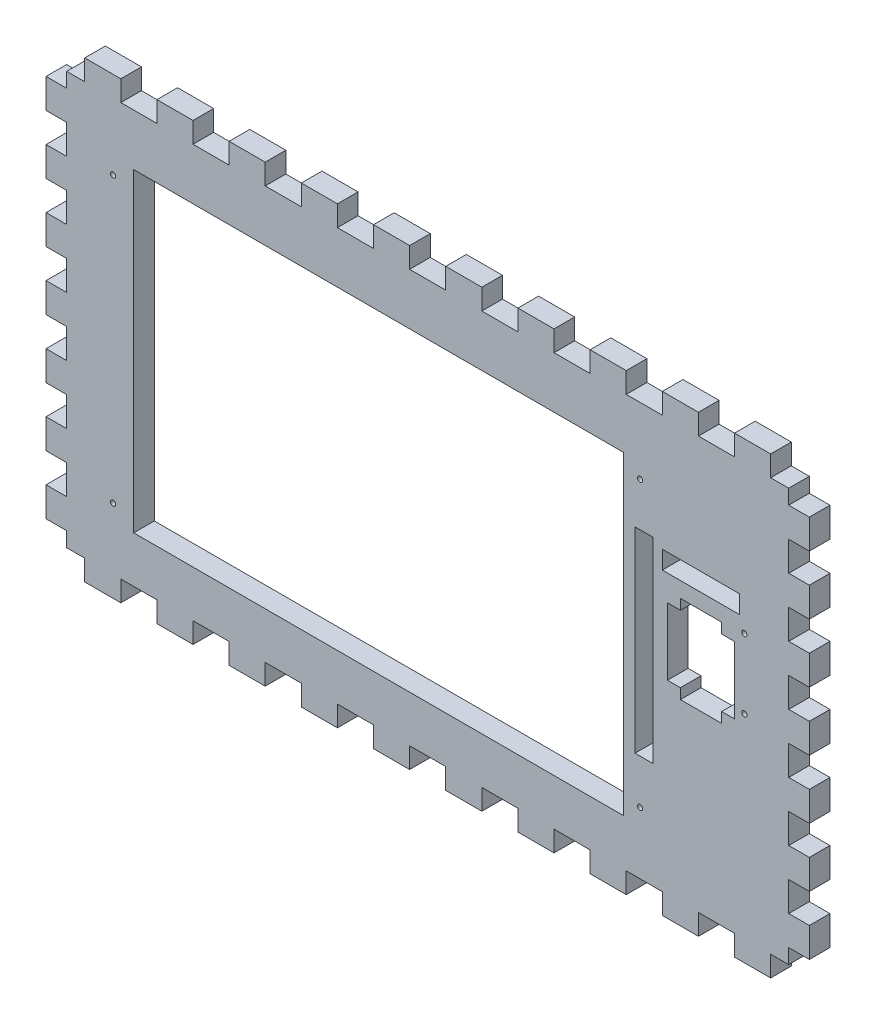
from build123d import *

# Parameters (mm, degrees)
SCHIZZO1_W                   = 140
SCHIZZO1_H                   = 80
SCHIZZO1_R                   = 0.5
SCHIZZO1_W_2                 = 95
SCHIZZO1_H_2                 = 61
SCHIZZO1_W_3                 = 3.5
SCHIZZO1_H_3                 = 38
SCHIZZO1_W_4                 = 15
SCHIZZO1_H_4                 = 3.5
ESTRUSIONE_ESTRUSIONE1_DEPTH = 4
SCHIZZO2_W                   = 7
SCHIZZO2_H                   = 4
ESTRUSIONE_ESTRUSIONE2_DEPTH = 4
RIPETIZIONE_A_L1_COUNT       = 10
RIPETIZIONE_A_L1_PITCH       = 14
SCHIZZO3_W                   = 4
SCHIZZO3_H                   = 5.714285714
ESTRUSIONE_ESTRUSIONE3_DEPTH = 4
RIPETIZIONE_A_L2_COUNT       = 7
RIPETIZIONE_A_L2_PITCH       = 11.428571429


with BuildPart() as part:
    # Schizzo1 → Estrusione-Estrusione1 (new body)
    with BuildSketch(Plane.XY):
        with Locations((70, 40)):
            Rectangle(SCHIZZO1_W, SCHIZZO1_H)
        with Locations((9, 12)):
            Circle(SCHIZZO1_R, mode=Mode.SUBTRACT)
        with Locations((60.5, 39.5)):
            Rectangle(SCHIZZO1_W_2, SCHIZZO1_H_2, mode=Mode.SUBTRACT)
        with Locations((111.2, 12)):
            Circle(SCHIZZO1_R, mode=Mode.SUBTRACT)
        with Locations((111.95, 39.6)):
            Rectangle(SCHIZZO1_W_3, SCHIZZO1_H_3, mode=Mode.SUBTRACT)
        with Locations((131.4, 37.8)):
            Circle(SCHIZZO1_R, mode=Mode.SUBTRACT)
        with Locations((9, 67.1)):
            Circle(SCHIZZO1_R, mode=Mode.SUBTRACT)
        Polygon((119, 36), (116.5, 36), (116.5, 49), (119, 49), (119, 51), (127, 51), (127, 49), (129.5, 49), (129.5, 36), (127, 36), (127, 34), (119, 34), align=None, mode=Mode.SUBTRACT)
        with Locations((131.4, 51.3)):
            Circle(SCHIZZO1_R, mode=Mode.SUBTRACT)
        with Locations((123, 55.75)):
            Rectangle(SCHIZZO1_W_4, SCHIZZO1_H_4, mode=Mode.SUBTRACT)
        with Locations((111.2, 67.1)):
            Circle(SCHIZZO1_R, mode=Mode.SUBTRACT)
    extrude(amount=ESTRUSIONE_ESTRUSIONE1_DEPTH)

    # Schizzo2 → Estrusione-Estrusione2 (add)
    with BuildSketch(Plane.XY.offset(4)):
        with Locations((7, 82)):
            Rectangle(SCHIZZO2_W, SCHIZZO2_H)
        with Locations((7, -2)):
            Rectangle(SCHIZZO2_W, SCHIZZO2_H)
    estrusione_estrusione2 = extrude(amount=-ESTRUSIONE_ESTRUSIONE2_DEPTH)

    # Ripetizione a L1: Estrusione-Estrusione2 ×10
    with Locations(*[(i * RIPETIZIONE_A_L1_PITCH, 0, 0) for i in range(1, RIPETIZIONE_A_L1_COUNT)]):
        add(estrusione_estrusione2)

    # Schizzo3 → Estrusione-Estrusione3 (add)
    with BuildSketch(Plane.XY.offset(4)):
        with Locations((-2, 74.285714286)):
            Rectangle(SCHIZZO3_W, SCHIZZO3_H)
        with Locations((142, 74.285714286)):
            Rectangle(SCHIZZO3_W, SCHIZZO3_H)
    estrusione_estrusione3 = extrude(amount=-ESTRUSIONE_ESTRUSIONE3_DEPTH)

    # Ripetizione a L2: Estrusione-Estrusione3 ×7
    with Locations(*[(0, -i * RIPETIZIONE_A_L2_PITCH, 0) for i in range(1, RIPETIZIONE_A_L2_COUNT)]):
        add(estrusione_estrusione3)


solid = part.part
